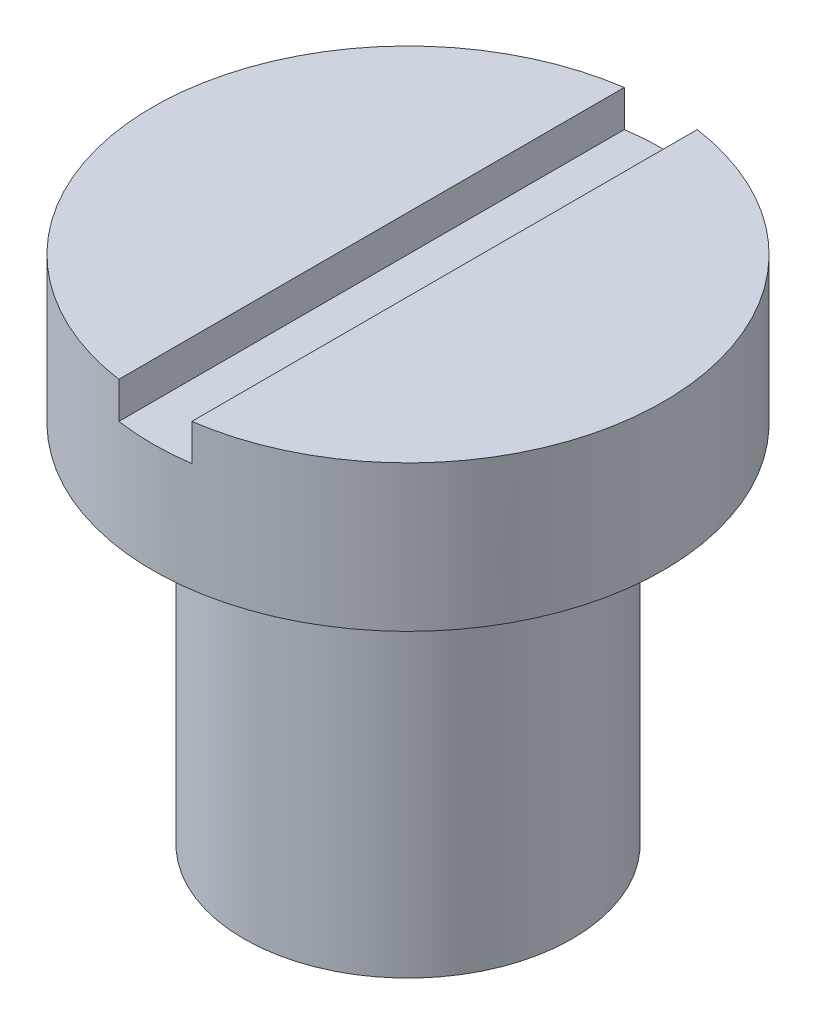
from build123d import *

# Parameters (mm, degrees)
SKETCH_3_W          = 2
SKETCH_3_H          = 2
CUT_EXTRUDE_1_DEPTH = 10


with BuildPart() as part:
    # 草图2 → 旋转1 (revolve)
    with BuildSketch(Plane.XY, mode=Mode.PRIVATE) as revolve_1_sk:
        Polygon((0, 0), (0, 14), (7, 14), (7, 10), (4.5, 10), (4.5, 0), align=None)
    revolve(revolve_1_sk.sketch.rotate(Axis((0, 0, 0), (0, 1, 0)), 90), axis=Axis((0, 0, 0), (0, 1, 0)))

    # 草图3 → 切除-拉伸1 (cut, symmetric)
    with BuildSketch(Plane.XY):
        with Locations((0, 14)):
            Rectangle(SKETCH_3_W, SKETCH_3_H)
    extrude(amount=CUT_EXTRUDE_1_DEPTH, both=True, mode=Mode.SUBTRACT)


solid = part.part
